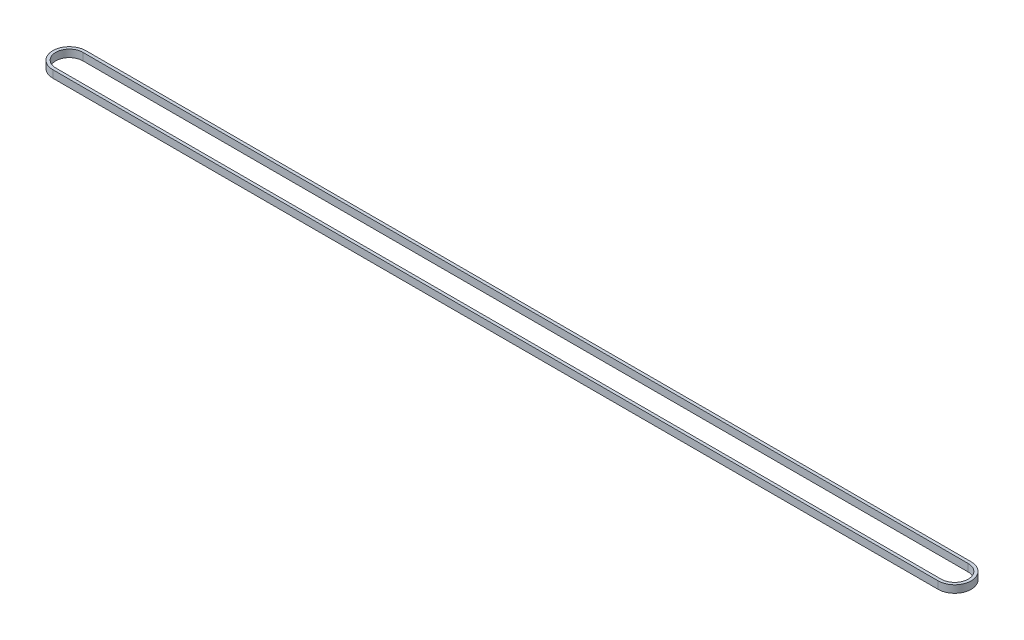
from build123d import *

# Parameters (mm, degrees)
BOSS_EXTRUDE1_DEPTH = 5


with BuildPart() as part:
    # Sketch1 → Boss-Extrude1 (new body)
    with BuildSketch(Plane(origin=(0, 0, 0), x_dir=(1, 0, 0), z_dir=(0, 1, 0))):
        with BuildLine():
            Line((-298.855, 11.15), (298.855, 11.15))
            ThreePointArc((298.855, 11.15), (310.005, 0), (298.855, -11.15))
            Line((298.855, -11.15), (-298.855, -11.15))
            ThreePointArc((-298.855, -11.15), (-310.005, 0), (-298.855, 11.15))
        make_face()
        with BuildLine():
            Line((298.855, -9.15), (-298.855, -9.15))
            ThreePointArc((-298.855, -9.15), (-308.005, 0), (-298.855, 9.15))
            Line((-298.855, 9.15), (298.855, 9.15))
            ThreePointArc((298.855, 9.15), (308.005, 0), (298.855, -9.15))
        make_face(mode=Mode.SUBTRACT)
    extrude(amount=BOSS_EXTRUDE1_DEPTH)


solid = part.part
